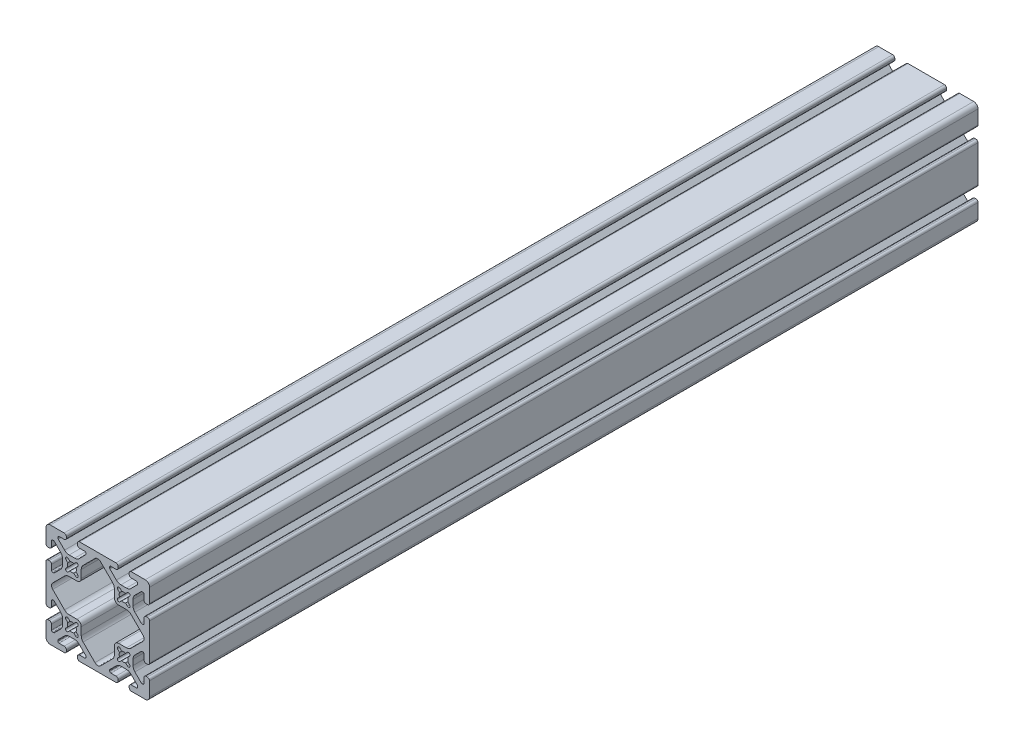
from build123d import *

# Parameters (mm, degrees)
BOSS_EXTRUDE1_DEPTH = 609.6


with BuildPart() as part:
    # Sketch1 → Boss-Extrude1 (new body)
    with BuildSketch(Plane(origin=(0, 0, -711.2), x_dir=(-1, 0, 0), z_dir=(0, 0, -1))):
        with BuildLine():
            Line((36.5252, 14.986), (35.6108, 14.986))
            ThreePointArc((35.6108, 14.986), (34.497248241, 14.524751759), (34.036, 13.4112))
            Line((34.036, 13.4112), (34.036, 9.652))
            ThreePointArc((34.036, 9.652), (33.775617928, 9.023382072), (33.147, 8.763))
            Line((33.147, 8.763), (32.578917816, 8.763))
            ThreePointArc((32.578917816, 8.763), (32.238712244, 8.830671096), (31.950299887, 9.023382072))
            Line((31.950299887, 9.023382072), (27.310840398, 13.662841561))
            ThreePointArc((27.310840398, 13.662841561), (26.281213183, 15.203787583), (25.919656187, 17.02145735))
            Line((25.919656187, 17.02145735), (25.919656187, 21.07854265))
            ThreePointArc((25.919656187, 21.07854265), (26.281213183, 22.896212417), (27.310840398, 24.437158439))
            Line((27.310840398, 24.437158439), (31.950299887, 29.076617928))
            ThreePointArc((31.950299887, 29.076617928), (32.238712244, 29.269328904), (32.578917816, 29.337))
            Line((32.578917816, 29.337), (33.147, 29.337))
            ThreePointArc((33.147, 29.337), (33.775617928, 29.076617928), (34.036, 28.448))
            Line((34.036, 28.448), (34.036, 24.6888))
            ThreePointArc((34.036, 24.6888), (34.497248241, 23.575248241), (35.6108, 23.114))
            Line((35.6108, 23.114), (36.5252, 23.114))
            ThreePointArc((36.5252, 23.114), (37.638751759, 23.575248241), (38.1, 24.6888))
            Line((38.1, 24.6888), (38.1, 34.925))
            ThreePointArc((38.1, 34.925), (37.17006403, 37.17006403), (34.925, 38.1))
            Line((34.925, 38.1), (24.6888, 38.1))
            ThreePointArc((24.6888, 38.1), (23.575248241, 37.638751759), (23.114, 36.5252))
            Line((23.114, 36.5252), (23.114, 35.6108))
            ThreePointArc((23.114, 35.6108), (23.575248241, 34.497248241), (24.6888, 34.036))
            Line((24.6888, 34.036), (28.448, 34.036))
            ThreePointArc((28.448, 34.036), (29.076617928, 33.775617928), (29.337, 33.147))
            Line((29.337, 33.147), (29.337, 32.578917816))
            ThreePointArc((29.337, 32.578917816), (29.269328904, 32.238712244), (29.076617928, 31.950299887))
            Line((29.076617928, 31.950299887), (24.437158439, 27.310840398))
            ThreePointArc((24.437158439, 27.310840398), (22.896212417, 26.281213183), (21.07854265, 25.919656187))
            Line((21.07854265, 25.919656187), (17.02145735, 25.919656187))
            ThreePointArc((17.02145735, 25.919656187), (15.203787583, 26.281213183), (13.662841561, 27.310840398))
            Line((13.662841561, 27.310840398), (9.023382072, 31.950299887))
            ThreePointArc((9.023382072, 31.950299887), (8.830671096, 32.238712244), (8.763, 32.578917816))
            Line((8.763, 32.578917816), (8.763, 33.147))
            ThreePointArc((8.763, 33.147), (9.023382072, 33.775617928), (9.652, 34.036))
            Line((9.652, 34.036), (13.4112, 34.036))
            ThreePointArc((13.4112, 34.036), (14.524751759, 34.497248241), (14.986, 35.6108))
            Line((14.986, 35.6108), (14.986, 36.5252))
            ThreePointArc((14.986, 36.5252), (14.524751759, 37.638751759), (13.4112, 38.1))
            Line((13.4112, 38.1), (-13.4112, 38.1))
            ThreePointArc((-13.4112, 38.1), (-14.524751759, 37.638751759), (-14.986, 36.5252))
            Line((-14.986, 36.5252), (-14.986, 35.6108))
            ThreePointArc((-14.986, 35.6108), (-14.524751759, 34.497248241), (-13.4112, 34.036))
            Line((-13.4112, 34.036), (-9.652, 34.036))
            ThreePointArc((-9.652, 34.036), (-9.023382072, 33.775617928), (-8.763, 33.147))
            Line((-8.763, 33.147), (-8.763, 32.578917816))
            ThreePointArc((-8.763, 32.578917816), (-8.830671096, 32.238712244), (-9.023382072, 31.950299887))
            Line((-9.023382072, 31.950299887), (-13.662841561, 27.310840398))
            ThreePointArc((-13.662841561, 27.310840398), (-15.203787583, 26.281213183), (-17.02145735, 25.919656187))
            Line((-17.02145735, 25.919656187), (-21.07854265, 25.919656187))
            ThreePointArc((-21.07854265, 25.919656187), (-22.896212417, 26.281213183), (-24.437158439, 27.310840398))
            Line((-24.437158439, 27.310840398), (-29.076617928, 31.950299887))
            ThreePointArc((-29.076617928, 31.950299887), (-29.269328904, 32.238712244), (-29.337, 32.578917816))
            Line((-29.337, 32.578917816), (-29.337, 33.147))
            ThreePointArc((-29.337, 33.147), (-29.076617928, 33.775617928), (-28.448, 34.036))
            Line((-28.448, 34.036), (-24.6888, 34.036))
            ThreePointArc((-24.6888, 34.036), (-23.575248241, 34.497248241), (-23.114, 35.6108))
            Line((-23.114, 35.6108), (-23.114, 36.5252))
            ThreePointArc((-23.114, 36.5252), (-23.575248241, 37.638751759), (-24.6888, 38.1))
            Line((-24.6888, 38.1), (-34.925, 38.1))
            ThreePointArc((-34.925, 38.1), (-37.17006403, 37.17006403), (-38.1, 34.925))
            Line((-38.1, 34.925), (-38.1, 24.6888))
            ThreePointArc((-38.1, 24.6888), (-37.638751759, 23.575248241), (-36.5252, 23.114))
            Line((-36.5252, 23.114), (-35.6108, 23.114))
            ThreePointArc((-35.6108, 23.114), (-34.497248241, 23.575248241), (-34.036, 24.6888))
            Line((-34.036, 24.6888), (-34.036, 28.448))
            ThreePointArc((-34.036, 28.448), (-33.775617928, 29.076617928), (-33.147, 29.337))
            Line((-33.147, 29.337), (-32.578917816, 29.337))
            ThreePointArc((-32.578917816, 29.337), (-32.238712244, 29.269328904), (-31.950299887, 29.076617928))
            Line((-31.950299887, 29.076617928), (-27.310840398, 24.437158439))
            ThreePointArc((-27.310840398, 24.437158439), (-26.281213183, 22.896212417), (-25.919656187, 21.07854265))
            Line((-25.919656187, 21.07854265), (-25.919656187, 17.02145735))
            ThreePointArc((-25.919656187, 17.02145735), (-26.281213183, 15.203787583), (-27.310840398, 13.662841561))
            Line((-27.310840398, 13.662841561), (-31.950299887, 9.023382072))
            ThreePointArc((-31.950299887, 9.023382072), (-32.238712244, 8.830671096), (-32.578917816, 8.763))
            Line((-32.578917816, 8.763), (-33.147, 8.763))
            ThreePointArc((-33.147, 8.763), (-33.775617928, 9.023382072), (-34.036, 9.652))
            Line((-34.036, 9.652), (-34.036, 13.4112))
            ThreePointArc((-34.036, 13.4112), (-34.497248241, 14.524751759), (-35.6108, 14.986))
            Line((-35.6108, 14.986), (-36.5252, 14.986))
            ThreePointArc((-36.5252, 14.986), (-37.638751759, 14.524751759), (-38.1, 13.4112))
            Line((-38.1, 13.4112), (-38.1, -13.4112))
            ThreePointArc((-38.1, -13.4112), (-37.638751759, -14.524751759), (-36.5252, -14.986))
            Line((-36.5252, -14.986), (-35.6108, -14.986))
            ThreePointArc((-35.6108, -14.986), (-34.497248241, -14.524751759), (-34.036, -13.4112))
            Line((-34.036, -13.4112), (-34.036, -9.652))
            ThreePointArc((-34.036, -9.652), (-33.775617928, -9.023382072), (-33.147, -8.763))
            Line((-33.147, -8.763), (-32.578917816, -8.763))
            ThreePointArc((-32.578917816, -8.763), (-32.238712244, -8.830671096), (-31.950299887, -9.023382072))
            Line((-31.950299887, -9.023382072), (-27.310840398, -13.662841561))
            ThreePointArc((-27.310840398, -13.662841561), (-26.281213183, -15.203787583), (-25.919656187, -17.02145735))
            Line((-25.919656187, -17.02145735), (-25.919656187, -21.07854265))
            ThreePointArc((-25.919656187, -21.07854265), (-26.281213183, -22.896212417), (-27.310840398, -24.437158439))
            Line((-27.310840398, -24.437158439), (-31.950299887, -29.076617928))
            ThreePointArc((-31.950299887, -29.076617928), (-32.238712244, -29.269328904), (-32.578917816, -29.337))
            Line((-32.578917816, -29.337), (-33.147, -29.337))
            ThreePointArc((-33.147, -29.337), (-33.775617928, -29.076617928), (-34.036, -28.448))
            Line((-34.036, -28.448), (-34.036, -24.6888))
            ThreePointArc((-34.036, -24.6888), (-34.497248241, -23.575248241), (-35.6108, -23.114))
            Line((-35.6108, -23.114), (-36.5252, -23.114))
            ThreePointArc((-36.5252, -23.114), (-37.638751759, -23.575248241), (-38.1, -24.6888))
            Line((-38.1, -24.6888), (-38.1, -34.925))
            ThreePointArc((-38.1, -34.925), (-37.17006403, -37.17006403), (-34.925, -38.1))
            Line((-34.925, -38.1), (-24.6888, -38.1))
            ThreePointArc((-24.6888, -38.1), (-23.575248241, -37.638751759), (-23.114, -36.5252))
            Line((-23.114, -36.5252), (-23.114, -35.6108))
            ThreePointArc((-23.114, -35.6108), (-23.575248241, -34.497248241), (-24.6888, -34.036))
            Line((-24.6888, -34.036), (-28.448, -34.036))
            ThreePointArc((-28.448, -34.036), (-29.076617928, -33.775617928), (-29.337, -33.147))
            Line((-29.337, -33.147), (-29.337, -32.578917816))
            ThreePointArc((-29.337, -32.578917816), (-29.269328904, -32.238712244), (-29.076617928, -31.950299887))
            Line((-29.076617928, -31.950299887), (-24.437158439, -27.310840398))
            ThreePointArc((-24.437158439, -27.310840398), (-22.896212417, -26.281213183), (-21.07854265, -25.919656187))
            Line((-21.07854265, -25.919656187), (-17.02145735, -25.919656187))
            ThreePointArc((-17.02145735, -25.919656187), (-15.203787583, -26.281213183), (-13.662841561, -27.310840398))
            Line((-13.662841561, -27.310840398), (-9.023382072, -31.950299887))
            ThreePointArc((-9.023382072, -31.950299887), (-8.830671096, -32.238712244), (-8.763, -32.578917816))
            Line((-8.763, -32.578917816), (-8.763, -33.147))
            ThreePointArc((-8.763, -33.147), (-9.023382072, -33.775617928), (-9.652, -34.036))
            Line((-9.652, -34.036), (-13.4112, -34.036))
            ThreePointArc((-13.4112, -34.036), (-14.524751759, -34.497248241), (-14.986, -35.6108))
            Line((-14.986, -35.6108), (-14.986, -36.5252))
            ThreePointArc((-14.986, -36.5252), (-14.524751759, -37.638751759), (-13.4112, -38.1))
            Line((-13.4112, -38.1), (13.4112, -38.1))
            ThreePointArc((13.4112, -38.1), (14.524751759, -37.638751759), (14.986, -36.5252))
            Line((14.986, -36.5252), (14.986, -35.6108))
            ThreePointArc((14.986, -35.6108), (14.524751759, -34.497248241), (13.4112, -34.036))
            Line((13.4112, -34.036), (9.652, -34.036))
            ThreePointArc((9.652, -34.036), (9.023382072, -33.775617928), (8.763, -33.147))
            Line((8.763, -33.147), (8.763, -32.578917816))
            ThreePointArc((8.763, -32.578917816), (8.830671096, -32.238712244), (9.023382072, -31.950299887))
            Line((9.023382072, -31.950299887), (13.662841561, -27.310840398))
            ThreePointArc((13.662841561, -27.310840398), (15.203787583, -26.281213183), (17.02145735, -25.919656187))
            Line((17.02145735, -25.919656187), (21.07854265, -25.919656187))
            ThreePointArc((21.07854265, -25.919656187), (22.896212417, -26.281213183), (24.437158439, -27.310840398))
            Line((24.437158439, -27.310840398), (29.076617928, -31.950299887))
            ThreePointArc((29.076617928, -31.950299887), (29.269328904, -32.238712244), (29.337, -32.578917816))
            Line((29.337, -32.578917816), (29.337, -33.147))
            ThreePointArc((29.337, -33.147), (29.076617928, -33.775617928), (28.448, -34.036))
            Line((28.448, -34.036), (24.6888, -34.036))
            ThreePointArc((24.6888, -34.036), (23.575248241, -34.497248241), (23.114, -35.6108))
            Line((23.114, -35.6108), (23.114, -36.5252))
            ThreePointArc((23.114, -36.5252), (23.575248241, -37.638751759), (24.6888, -38.1))
            Line((24.6888, -38.1), (34.925, -38.1))
            ThreePointArc((34.925, -38.1), (37.17006403, -37.17006403), (38.1, -34.925))
            Line((38.1, -34.925), (38.1, -24.6888))
            ThreePointArc((38.1, -24.6888), (37.638751759, -23.575248241), (36.5252, -23.114))
            Line((36.5252, -23.114), (35.6108, -23.114))
            ThreePointArc((35.6108, -23.114), (34.497248241, -23.575248241), (34.036, -24.6888))
            Line((34.036, -24.6888), (34.036, -28.448))
            ThreePointArc((34.036, -28.448), (33.775617928, -29.076617928), (33.147, -29.337))
            Line((33.147, -29.337), (32.578917816, -29.337))
            ThreePointArc((32.578917816, -29.337), (32.238712244, -29.269328904), (31.950299887, -29.076617928))
            Line((31.950299887, -29.076617928), (27.310840398, -24.437158439))
            ThreePointArc((27.310840398, -24.437158439), (26.281213183, -22.896212417), (25.919656187, -21.07854265))
            Line((25.919656187, -21.07854265), (25.919656187, -17.02145735))
            ThreePointArc((25.919656187, -17.02145735), (26.281213183, -15.203787583), (27.310840398, -13.662841561))
            Line((27.310840398, -13.662841561), (31.950299887, -9.023382072))
            ThreePointArc((31.950299887, -9.023382072), (32.238712244, -8.830671096), (32.578917816, -8.763))
            Line((32.578917816, -8.763), (33.147, -8.763))
            ThreePointArc((33.147, -8.763), (33.775617928, -9.023382072), (34.036, -9.652))
            Line((34.036, -9.652), (34.036, -13.4112))
            ThreePointArc((34.036, -13.4112), (34.497248241, -14.524751759), (35.6108, -14.986))
            Line((35.6108, -14.986), (36.5252, -14.986))
            ThreePointArc((36.5252, -14.986), (37.638751759, -14.524751759), (38.1, -13.4112))
            Line((38.1, -13.4112), (38.1, 13.4112))
            ThreePointArc((38.1, 13.4112), (37.638751759, 14.524751759), (36.5252, 14.986))
        make_face()
        with BuildLine():
            Line((24.437158439, 10.789159602), (33.160859133, 2.065458908))
            ThreePointArc((33.160859133, 2.065458908), (34.016400226, 0), (33.160859133, -2.065458908))
            Line((33.160859133, -2.065458908), (24.437158439, -10.789159602))
            ThreePointArc((24.437158439, -10.789159602), (22.896212417, -11.818786817), (21.07854265, -12.180343813))
            Line((21.07854265, -12.180343813), (15.355343813, -12.180343813))
            ThreePointArc((15.355343813, -12.180343813), (13.110279783, -13.110279783), (12.180343813, -15.355343813))
            Line((12.180343813, -15.355343813), (12.180343813, -21.07854265))
            ThreePointArc((12.180343813, -21.07854265), (11.818786817, -22.896212417), (10.789159602, -24.437158439))
            Line((10.789159602, -24.437158439), (2.065458908, -33.160859133))
            ThreePointArc((2.065458908, -33.160859133), (0, -34.016400226), (-2.065458908, -33.160859133))
            Line((-2.065458908, -33.160859133), (-10.789159602, -24.437158439))
            ThreePointArc((-10.789159602, -24.437158439), (-11.818786817, -22.896212417), (-12.180343813, -21.07854265))
            Line((-12.180343813, -21.07854265), (-12.180343813, -15.355343813))
            ThreePointArc((-12.180343813, -15.355343813), (-13.110279783, -13.110279783), (-15.355343813, -12.180343813))
            Line((-15.355343813, -12.180343813), (-21.07854265, -12.180343813))
            ThreePointArc((-21.07854265, -12.180343813), (-22.896212417, -11.818786817), (-24.437158439, -10.789159602))
            Line((-24.437158439, -10.789159602), (-33.160859133, -2.065458908))
            ThreePointArc((-33.160859133, -2.065458908), (-34.016400226, 0), (-33.160859133, 2.065458908))
            Line((-33.160859133, 2.065458908), (-24.437158439, 10.789159602))
            ThreePointArc((-24.437158439, 10.789159602), (-22.896212417, 11.818786817), (-21.07854265, 12.180343813))
            Line((-21.07854265, 12.180343813), (-15.355343813, 12.180343813))
            ThreePointArc((-15.355343813, 12.180343813), (-13.110279783, 13.110279783), (-12.180343813, 15.355343813))
            Line((-12.180343813, 15.355343813), (-12.180343813, 21.07854265))
            ThreePointArc((-12.180343813, 21.07854265), (-11.818786817, 22.896212417), (-10.789159602, 24.437158439))
            Line((-10.789159602, 24.437158439), (-2.065458908, 33.160859133))
            ThreePointArc((-2.065458908, 33.160859133), (0, 34.016400226), (2.065458908, 33.160859133))
            Line((2.065458908, 33.160859133), (10.789159602, 24.437158439))
            ThreePointArc((10.789159602, 24.437158439), (11.818786817, 22.896212417), (12.180343813, 21.07854265))
            Line((12.180343813, 21.07854265), (12.180343813, 15.355343813))
            ThreePointArc((12.180343813, 15.355343813), (13.110279783, 13.110279783), (15.355343813, 12.180343813))
            Line((15.355343813, 12.180343813), (21.07854265, 12.180343813))
            ThreePointArc((21.07854265, 12.180343813), (22.896212417, 11.818786817), (24.437158439, 10.789159602))
        make_face(mode=Mode.SUBTRACT)
        with BuildLine():
            Line((22.067876996, 17.648569092), (23.393300892, 16.32314521))
            ThreePointArc((23.393300892, 16.32314521), (23.393300901, 14.706699151), (21.776854842, 14.706699139))
            Line((21.776854842, 14.706699139), (20.451430941, 16.032123019))
            ThreePointArc((20.451430941, 16.032123019), (19.049999941, 15.722600076), (17.648568944, 16.032123029))
            Line((17.648568944, 16.032123029), (16.32314506, 14.706699139))
            ThreePointArc((16.32314506, 14.706699139), (14.706699047, 14.706699135), (14.706699046, 16.323145148))
            Line((14.706699046, 16.323145148), (16.032122935, 17.648569037))
            ThreePointArc((16.032122935, 17.648569037), (15.722599982, 19.050000008), (16.032122902, 20.451430985))
            Line((16.032122902, 20.451430985), (14.706698995, 21.776854871))
            ThreePointArc((14.706698995, 21.776854871), (14.706698983, 23.393300953), (16.323145064, 23.393300962))
            Line((16.323145064, 23.393300962), (17.648568966, 22.067877075))
            ThreePointArc((17.648568966, 22.067877075), (19.049999965, 22.377400018), (20.451430963, 22.067877065))
            Line((20.451430963, 22.067877065), (21.776854845, 23.393300947))
            ThreePointArc((21.776854845, 23.393300947), (23.393300836, 23.393300948), (23.393300839, 21.776854957))
            Line((23.393300839, 21.776854957), (22.067876963, 20.451431073))
            ThreePointArc((22.067876963, 20.451431073), (22.377399924, 19.050000086), (22.067876996, 17.648569092))
        make_face(mode=Mode.SUBTRACT)
        with BuildLine():
            Line((20.451431002, -16.03212291), (21.776854883, -14.706699015))
            ThreePointArc((21.776854883, -14.706699015), (23.393300943, -14.706699005), (23.393300955, -16.323145064))
            Line((23.393300955, -16.323145064), (22.067877075, -17.648568966))
            ThreePointArc((22.067877075, -17.648568966), (22.377400018, -19.049999965), (22.067877065, -20.451430963))
            Line((22.067877065, -20.451430963), (23.393300947, -21.776854845))
            ThreePointArc((23.393300947, -21.776854845), (23.393300948, -23.393300836), (21.776854957, -23.393300839))
            Line((21.776854957, -23.393300839), (20.451431073, -22.067876963))
            ThreePointArc((20.451431073, -22.067876963), (19.050000095, -22.377399924), (17.648569108, -22.067877004))
            Line((17.648569108, -22.067877004), (16.323145222, -23.393300911))
            ThreePointArc((16.323145222, -23.393300911), (14.706699141, -23.393300923), (14.706699131, -21.776854842))
            Line((14.706699131, -21.776854842), (16.032123019, -20.451430941))
            ThreePointArc((16.032123019, -20.451430941), (15.722600076, -19.049999941), (16.032123029, -17.648568944))
            Line((16.032123029, -17.648568944), (14.706699139, -16.32314506))
            ThreePointArc((14.706699139, -16.32314506), (14.706699135, -14.706699047), (16.323145148, -14.706699046))
            Line((16.323145148, -14.706699046), (17.648569037, -16.032122935))
            ThreePointArc((17.648569037, -16.032122935), (19.050000017, -15.722599982), (20.451431002, -16.03212291))
        make_face(mode=Mode.SUBTRACT)
        with BuildLine():
            Line((-16.032122931, 17.648569033), (-14.706699057, 16.323145159))
            ThreePointArc((-14.706699057, 16.323145159), (-14.706699056, 14.706699062), (-16.323145153, 14.706699059))
            Line((-16.323145153, 14.706699059), (-17.648569033, 16.032122931))
            ThreePointArc((-17.648569033, 16.032122931), (-19.049999991, 15.7226), (-20.45143095, 16.032122923))
            Line((-20.45143095, 16.032122923), (-21.776854828, 14.706699039))
            ThreePointArc((-21.776854828, 14.706699039), (-23.393300942, 14.706699034), (-23.393300946, 16.323145148))
            Line((-23.393300946, 16.323145148), (-22.067877069, 17.648569033))
            ThreePointArc((-22.067877069, 17.648569033), (-22.3774, 19.049999991), (-22.067877077, 20.45143095))
            Line((-22.067877077, 20.45143095), (-23.393300967, 21.776854834))
            ThreePointArc((-23.393300967, 21.776854834), (-23.393300971, 23.393300953), (-21.776854852, 23.393300954))
            Line((-21.776854852, 23.393300954), (-20.451430967, 22.067877069))
            ThreePointArc((-20.451430967, 22.067877069), (-19.050000009, 22.3774), (-17.64856905, 22.067877077))
            Line((-17.64856905, 22.067877077), (-16.323145172, 23.393300961))
            ThreePointArc((-16.323145172, 23.393300961), (-14.706699058, 23.393300966), (-14.706699054, 21.776854852))
            Line((-14.706699054, 21.776854852), (-16.032122931, 20.451430967))
            ThreePointArc((-16.032122931, 20.451430967), (-15.7226, 19.05), (-16.032122931, 17.648569033))
        make_face(mode=Mode.SUBTRACT)
        with BuildLine():
            Line((-17.648569033, -16.032122931), (-16.323145159, -14.706699057))
            ThreePointArc((-16.323145159, -14.706699057), (-14.706699062, -14.706699056), (-14.706699059, -16.323145153))
            Line((-14.706699059, -16.323145153), (-16.032122931, -17.648569033))
            ThreePointArc((-16.032122931, -17.648569033), (-15.7226, -19.049999991), (-16.032122923, -20.45143095))
            Line((-16.032122923, -20.45143095), (-14.706699039, -21.776854828))
            ThreePointArc((-14.706699039, -21.776854828), (-14.706699034, -23.393300942), (-16.323145148, -23.393300946))
            Line((-16.323145148, -23.393300946), (-17.648569033, -22.067877069))
            ThreePointArc((-17.648569033, -22.067877069), (-19.049999991, -22.3774), (-20.45143095, -22.067877077))
            Line((-20.45143095, -22.067877077), (-21.776854834, -23.393300967))
            ThreePointArc((-21.776854834, -23.393300967), (-23.393300953, -23.393300971), (-23.393300954, -21.776854852))
            Line((-23.393300954, -21.776854852), (-22.067877069, -20.451430967))
            ThreePointArc((-22.067877069, -20.451430967), (-22.3774, -19.050000009), (-22.067877077, -17.64856905))
            Line((-22.067877077, -17.64856905), (-23.393300961, -16.323145172))
            ThreePointArc((-23.393300961, -16.323145172), (-23.393300966, -14.706699058), (-21.776854852, -14.706699054))
            Line((-21.776854852, -14.706699054), (-20.451430967, -16.032122931))
            ThreePointArc((-20.451430967, -16.032122931), (-19.05, -15.7226), (-17.648569033, -16.032122931))
        make_face(mode=Mode.SUBTRACT)
    extrude(amount=-BOSS_EXTRUDE1_DEPTH)


solid = part.part
